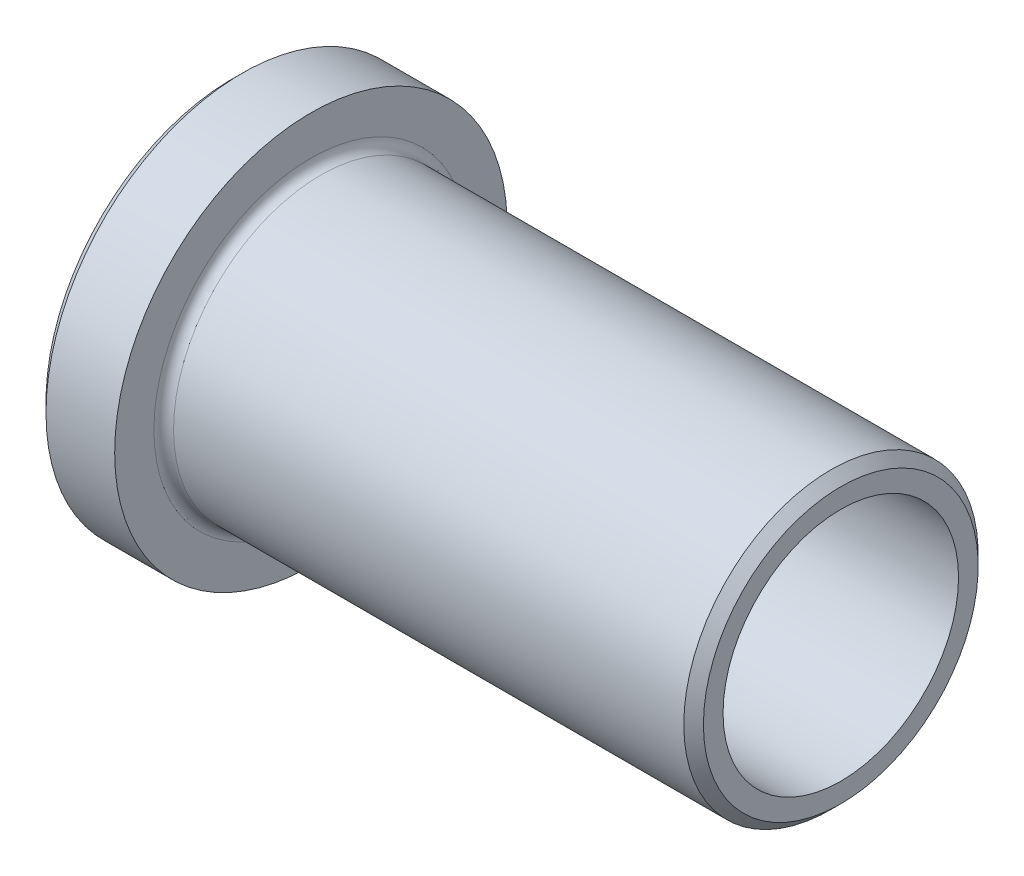
from build123d import *

# Parameters (mm, degrees)
FILLET1_R     = 0.5
CHAMFER1_SIZE = 0.5


with BuildPart() as part:
    # Sketch1 → Revolve1 (revolve)
    with BuildSketch(Plane.XY, mode=Mode.PRIVATE) as revolve1_sk:
        Polygon((0, 6), (0, 10), (4, 10), (4, 7.5), (31, 7.5), (31, 6), align=None)
    revolve(revolve1_sk.sketch.rotate(Axis((-6.114398422, 0, 0), (1, 0, 0)), 90), axis=Axis((-6.114398422, 0, 0), (1, 0, 0)))

    # Fillet1
    fillet1_edges = [part.edges().sort_by_distance(p)[0] for p in [
        (4, 0, -7.5),
    ]]
    fillet(fillet1_edges, radius=FILLET1_R)

    # Chamfer1
    chamfer1_edges = [part.edges().sort_by_distance(p)[0] for p in [
        (31, 0, -7.5),
        (0, 0, -10),
    ]]
    chamfer(chamfer1_edges, length=CHAMFER1_SIZE)


solid = part.part
